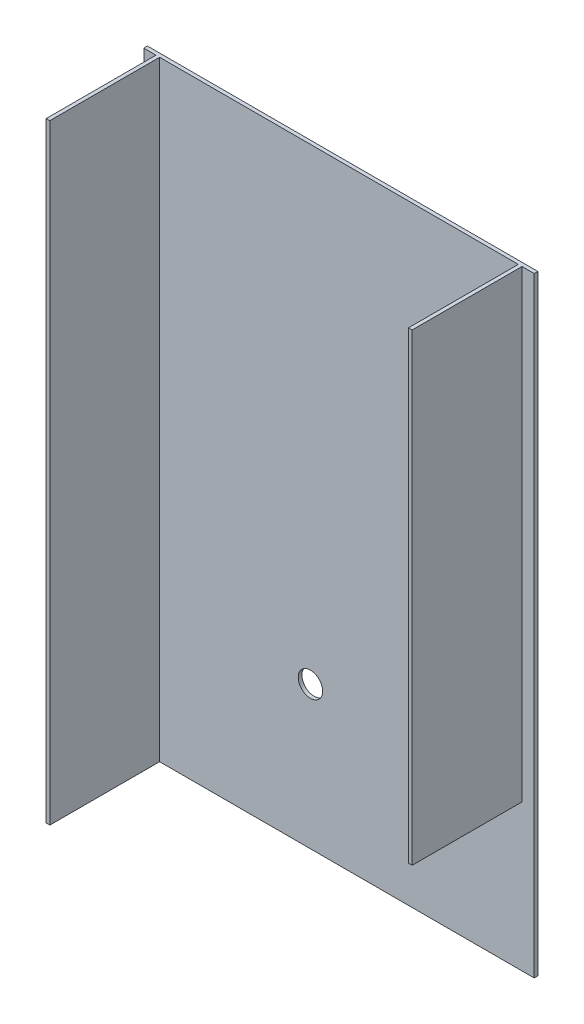
from build123d import *

# Parameters (mm, degrees)
SKETCH3_W           = 160
SKETCH3_H           = 250
BOSS_EXTRUDE2_DEPTH = 1.5
SKETCH4_R           = 5
CUT_EXTRUDE4_DEPTH  = 149.415801046
SKETCH6_W           = 1.5
SKETCH6_H           = 190
BOSS_EXTRUDE4_DEPTH = 45


with BuildPart() as part:
    # Sketch3 → Boss-Extrude2 (new body)
    with BuildSketch(Plane.XY):
        Rectangle(SKETCH3_W, SKETCH3_H)
    extrude(amount=BOSS_EXTRUDE2_DEPTH)

    # Sketch4 → Cut-Extrude4 (cut, through all)
    with BuildSketch(Plane.XY):
        with Locations((-11.69, -66.6)):
            Circle(SKETCH4_R)
    extrude(amount=CUT_EXTRUDE4_DEPTH, mode=Mode.SUBTRACT)

    # Sketch6 → Boss-Extrude4 (add)
    with BuildSketch(Plane.XY.offset(1.5)):
        Polygon((-73.5, 13.5), (-73.5, 125), (-75, 125), (-75, -125), (-73.5, -125), align=None)
        with Locations((74.25, 30)):
            Rectangle(SKETCH6_W, SKETCH6_H)
    extrude(amount=BOSS_EXTRUDE4_DEPTH)


solid = part.part
